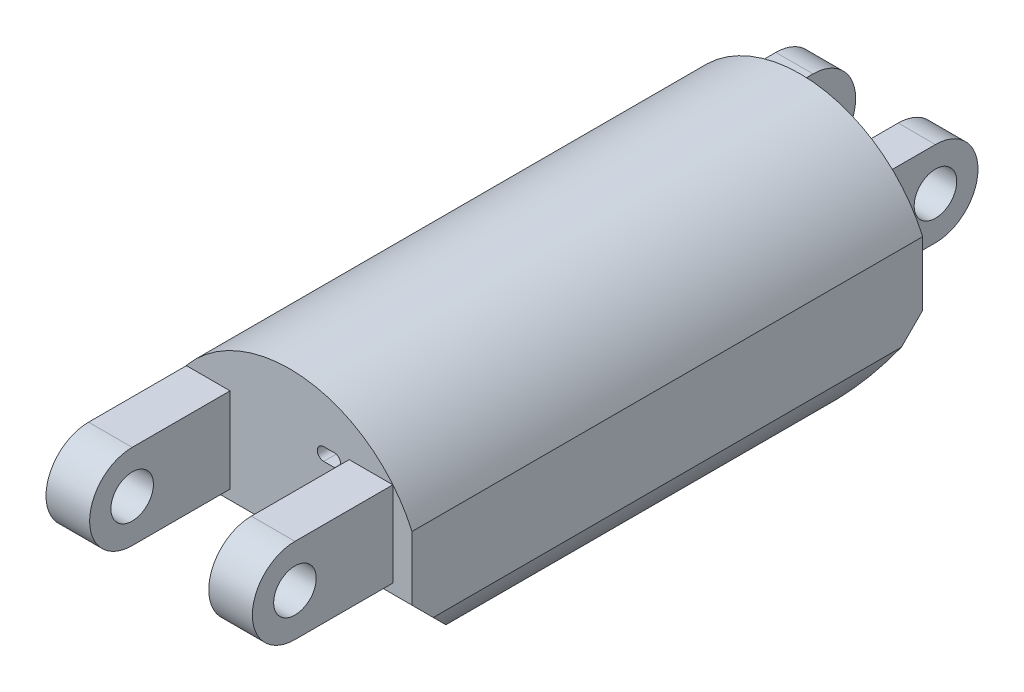
from build123d import *

# Parameters (mm, degrees)
BOSS_EXTRUDE1_DEPTH      = 15.24
CUT_EXTRUDE1_DEPTH       = 24.290307668
CUT_EXTRUDE2_DEPTH       = 36.202432178
SKETCH4_R                = 1.27
BOSS_EXTRUDE2_DEPTH      = 0.635
SKETCH5_R                = 1.27
BOSS_EXTRUDE3_DEPTH      = 1.27
MIRROR2_COPY_1_SKETCH_R  = 1.27
MIRROR2_COPY_1_DEPTH     = 0.635
MIRROR2_COPY_2_SKETCH_R  = 1.27
MIRROR2_COPY_2_DEPTH     = 1.27
SKETCH21_R               = 1.27
CUT_EXTRUDE9_DEPTH       = 1.905
SKETCH22_R               = 1.27
BOSS_EXTRUDE12_DEPTH     = 1.27
MIRROR8_COPY_1_SKETCH_R  = 1.27
MIRROR8_COPY_1_DEPTH     = 1.27
CUT_EXTRUDE10_DEPTH      = 2.54
CUT_EXTRUDE10_DEPTH_BACK = 2.54
SKETCH23_R               = 1.27
SKETCH24_R               = 1.27
BOSS_EXTRUDE13_DEPTH     = 0.635
BOSS_EXTRUDE14_DEPTH     = 2.2225
BOSS_EXTRUDE15_START     = -2.2225
BOSS_EXTRUDE15_DEPTH     = 2.2225
CUT_EXTRUDE11_REACH      = 30.027
SKETCH27_R               = 1.27
CUT_EXTRUDE12_DEPTH      = 16.51
SKETCH29_R               = 1.27
CUT_EXTRUDE13_DEPTH      = 3.556
SKETCH30_R               = 1.27
BOSS_EXTRUDE16_DEPTH     = 2.032
BOSS_EXTRUDE17_START     = 2.032
SKETCH31_R               = 1.27
BOSS_EXTRUDE17_DEPTH     = 2.032
CUT_EXTRUDE14_DEPTH      = 13.97
SKETCH33_W               = 0.284935897
SKETCH33_H               = 2.320192308
CUT_EXTRUDE15_DEPTH      = 1


with BuildPart() as part:
    # Sketch1 → Boss-Extrude1 (new, symmetric)
    with BuildSketch(Plane.XY):
        with BuildLine():
            Line((0, 0), (0, 5.08))
            ThreePointArc((0, 5.08), (7.3025, 9.8425), (14.605, 5.08))
            Line((14.605, 5.08), (14.605, 0))
            ThreePointArc((14.605, 0), (7.3025, -4.7625), (0, 0))
        make_face()
    extrude(amount=BOSS_EXTRUDE1_DEPTH, both=True)

    # Sketch2 → Cut-Extrude1 (cut, through all)
    with BuildSketch(Plane(origin=(0, 0, 0), x_dir=(0, 0, -1), z_dir=(1, 0, 0))):
        Polygon((-15.24, 1.27), (-15.24, -4.7625), (-9.2075, -4.7625), align=None)
        Polygon((15.24, -4.7625), (9.2075, -4.7625), (15.24, 1.27), align=None)
    extrude(amount=CUT_EXTRUDE1_DEPTH, mode=Mode.SUBTRACT)

    # Sketch3 → Cut-Extrude2 (cut, through all)
    with BuildSketch(Plane.XY.offset(15.24)):
        with BuildLine():
            ThreePointArc((4.23940993, -2.656973684), (7.3025, -3.4925), (10.36559007, -2.656973684))
            ThreePointArc((10.36559007, -2.656973684), (7.3025, -0.3175), (4.23940993, -2.656973684))
        make_face()
    extrude(amount=-CUT_EXTRUDE2_DEPTH, mode=Mode.SUBTRACT)

    # Sketch4 → Boss-Extrude2 (add, symmetric)
    with BuildSketch(Plane(origin=(9.525, 0, 0), x_dir=(0, 0, -1), z_dir=(1, 0, 0))):
        with BuildLine():
            Line((-15.24, 6.9215), (-18.542, 6.9215))
            ThreePointArc((-18.542, 6.9215), (-21.082, 4.3815), (-18.542, 1.8415))
            Line((-18.542, 1.8415), (-15.24, 1.8415))
            Line((-15.24, 1.8415), (-15.24, 6.9215))
        make_face()
        with Locations((-18.542, 4.3815)):
            Circle(SKETCH4_R, mode=Mode.SUBTRACT)
    boss_extrude2 = extrude(amount=BOSS_EXTRUDE2_DEPTH, both=True)

    # Sketch5 → Boss-Extrude3 (add)
    with BuildSketch(Plane.ZY.offset(-8.89)):
        with BuildLine():
            Line((15.24, 6.9215), (15.24, 1.8415))
            Line((15.24, 1.8415), (18.542, 1.8415))
            ThreePointArc((18.542, 1.8415), (21.082, 4.3815), (18.542, 6.9215))
            Line((18.542, 6.9215), (15.24, 6.9215))
        make_face()
        with Locations((18.542, 4.3815)):
            Circle(SKETCH5_R, mode=Mode.SUBTRACT)
    boss_extrude3 = extrude(amount=BOSS_EXTRUDE3_DEPTH)

    # Mirror1: Boss-Extrude2, Boss-Extrude3 across plane
    add(boss_extrude2.mirror(Plane(origin=(7.3025, 0, 0), x_dir=(0, 0, 1), z_dir=(1, 0, 0))))
    add(boss_extrude3.mirror(Plane(origin=(7.3025, 0, 0), x_dir=(0, 0, 1), z_dir=(1, 0, 0))))

    # Mirror2: Boss-Extrude2, Boss-Extrude3 across plane
    add(boss_extrude2.mirror(Plane.XY))
    add(boss_extrude3.mirror(Plane.XY))

    # Mirror2 copy 1 sketch → Mirror2 copy 1 (add, symmetric)
    with BuildSketch(Plane.ZY.offset(-5.08)):
        with BuildLine():
            Line((-15.24, 6.9215), (-18.542, 6.9215))
            ThreePointArc((-18.542, 6.9215), (-21.082, 4.3815), (-18.542, 1.8415))
            Line((-18.542, 1.8415), (-15.24, 1.8415))
            Line((-15.24, 1.8415), (-15.24, 6.9215))
        make_face()
        with Locations((-18.542, 4.3815)):
            Circle(MIRROR2_COPY_1_SKETCH_R, mode=Mode.SUBTRACT)
    extrude(amount=MIRROR2_COPY_1_DEPTH, both=True)

    # Mirror2 copy 2 sketch → Mirror2 copy 2 (add)
    with BuildSketch(Plane(origin=(5.715, 0, 0), x_dir=(0, 0, -1), z_dir=(1, 0, 0))):
        with BuildLine():
            Line((15.24, 6.9215), (15.24, 1.8415))
            Line((15.24, 1.8415), (18.542, 1.8415))
            ThreePointArc((18.542, 1.8415), (21.082, 4.3815), (18.542, 6.9215))
            Line((18.542, 6.9215), (15.24, 6.9215))
        make_face()
        with Locations((18.542, 4.3815)):
            Circle(MIRROR2_COPY_2_SKETCH_R, mode=Mode.SUBTRACT)
    extrude(amount=MIRROR2_COPY_2_DEPTH)

    # Sketch21 → Cut-Extrude9 (cut, symmetric)
    with BuildSketch(Plane(origin=(7.3025, 0, 0), x_dir=(0, 0, -1), z_dir=(1, 0, 0))):
        with BuildLine():
            Line((-15.24, 1.8415), (-15.24, 6.9215))
            Line((-15.24, 6.9215), (-18.542, 6.9215))
            ThreePointArc((-18.542, 6.9215), (-21.082, 4.3815), (-18.542, 1.8415))
            Line((-18.542, 1.8415), (-15.24, 1.8415))
        make_face()
        with Locations((-18.542, 4.3815)):
            Circle(SKETCH21_R, mode=Mode.SUBTRACT)
    cut_extrude9 = extrude(amount=CUT_EXTRUDE9_DEPTH, both=True, mode=Mode.SUBTRACT)

    # Sketch22 → Boss-Extrude12 (add)
    with BuildSketch(Plane(origin=(10.16, 0, 0), x_dir=(0, 0, -1), z_dir=(1, 0, 0))):
        with BuildLine():
            Line((-15.24, 1.8415), (-15.24, 6.9215))
            Line((-15.24, 6.9215), (-18.542, 6.9215))
            ThreePointArc((-18.542, 6.9215), (-21.082, 4.3815), (-18.542, 1.8415))
            Line((-18.542, 1.8415), (-15.24, 1.8415))
        make_face()
        with Locations((-18.542, 4.3815)):
            Circle(SKETCH22_R, mode=Mode.SUBTRACT)
    boss_extrude12 = extrude(amount=BOSS_EXTRUDE12_DEPTH)

    # Mirror7: Boss-Extrude12 across plane
    add(boss_extrude12.mirror(Plane(origin=(7.3025, 0, 0), x_dir=(0, 0, 1), z_dir=(1, 0, 0))))

    # Mirror8: Cut-Extrude9, Boss-Extrude12 across plane
    add(cut_extrude9.mirror(Plane.XY), mode=Mode.SUBTRACT)
    add(boss_extrude12.mirror(Plane.XY))

    # Mirror8 copy 1 sketch → Mirror8 copy 1 (add)
    with BuildSketch(Plane.ZY.offset(-4.445)):
        with BuildLine():
            Line((-15.24, 1.8415), (-15.24, 6.9215))
            Line((-15.24, 6.9215), (-18.542, 6.9215))
            ThreePointArc((-18.542, 6.9215), (-21.082, 4.3815), (-18.542, 1.8415))
            Line((-18.542, 1.8415), (-15.24, 1.8415))
        make_face()
        with Locations((-18.542, 4.3815)):
            Circle(MIRROR8_COPY_1_SKETCH_R, mode=Mode.SUBTRACT)
    extrude(amount=MIRROR8_COPY_1_DEPTH)

    # Sketch23 → Cut-Extrude10 (cut, two sides: drawn at the far end of the back side and taken through both)
    with BuildSketch(Plane(origin=(7.3025, 0, 0), x_dir=(0, 0, -1), z_dir=(1, 0, 0)).offset(-CUT_EXTRUDE10_DEPTH_BACK)):
        with BuildLine():
            Line((15.24, 1.8415), (18.542, 1.8415))
            ThreePointArc((18.542, 1.8415), (21.082, 4.3815), (18.542, 6.9215))
            Line((18.542, 6.9215), (15.24, 6.9215))
            Line((15.24, 6.9215), (15.24, 1.8415))
        make_face()
        with Locations((18.542, 4.3815)):
            Circle(SKETCH23_R, mode=Mode.SUBTRACT)
    extrude(amount=CUT_EXTRUDE10_DEPTH + CUT_EXTRUDE10_DEPTH_BACK, mode=Mode.SUBTRACT)

    # Sketch24 → Boss-Extrude13 (add)
    with BuildSketch(Plane.ZY.offset(-3.175)):
        with BuildLine():
            Line((-18.542, 1.8415), (-15.24, 1.8415))
            Line((-15.24, 1.8415), (-15.24, 6.9215))
            Line((-15.24, 6.9215), (-18.542, 6.9215))
            ThreePointArc((-18.542, 6.9215), (-21.082, 4.3815), (-18.542, 1.8415))
        make_face()
        with Locations(Location((-18.542, 4.3815, 0), (0, 0, 180))):
            Circle(SKETCH24_R, mode=Mode.SUBTRACT)
    boss_extrude13 = extrude(amount=BOSS_EXTRUDE13_DEPTH)

    # Mirror9: Boss-Extrude13 across plane
    add(boss_extrude13.mirror(Plane(origin=(7.3025, 0, 0), x_dir=(0, 0, 1), z_dir=(1, 0, 0))))

    # Sketch25 → Boss-Extrude14 (add)
    with BuildSketch(Plane(origin=(11.43, 0, 0), x_dir=(0, 0, -1), z_dir=(1, 0, 0))):
        with BuildLine():
            Line((-15.24, 6.9215), (-21.082, 6.9215))
            ThreePointArc((-21.082, 6.9215), (-23.622, 4.3815), (-21.082, 1.8415))
            Line((-21.082, 1.8415), (-15.24, 1.8415))
            Line((-15.24, 1.8415), (-15.24, 6.9215))
        make_face()
    extrude(amount=-BOSS_EXTRUDE14_DEPTH)

    # Sketch26 → Boss-Extrude15 (add)
    with BuildSketch(Plane.ZY.offset(-3.175).offset(BOSS_EXTRUDE15_START)):
        with BuildLine():
            Line((15.24, 6.9215), (21.082, 6.9215))
            ThreePointArc((21.082, 6.9215), (23.622, 4.3815), (21.082, 1.8415))
            Line((21.082, 1.8415), (15.24, 1.8415))
            Line((15.24, 1.8415), (15.24, 6.9215))
        make_face()
    extrude(amount=BOSS_EXTRUDE15_DEPTH)

    # Sketch27 → Cut-Extrude11 (cut, up to next)
    with BuildSketch(Plane(origin=(11.43, 0, 0), x_dir=(0, 0, -1), z_dir=(1, 0, 0)), mode=Mode.PRIVATE) as cut_extrude11_sk1:
        with Locations((-21.082, 4.3815)):
            Circle(SKETCH27_R)
    cut_extrude11_tool1 = extrude(cut_extrude11_sk1.sketch, amount=-CUT_EXTRUDE11_REACH, mode=Mode.PRIVATE) & part.part
    add(cut_extrude11_tool1.solids().sort_by_distance((11.43, 4.3815, 21.082))[0], mode=Mode.SUBTRACT)
    add(cut_extrude11_tool1.solids().sort_by_distance((11.43, 4.3815, 21.082))[1], mode=Mode.SUBTRACT)

    # Sketch28 → Cut-Extrude12 (cut)
    with BuildSketch(Plane(origin=(0, 0, -15.24), x_dir=(-1, 0, 0), z_dir=(0, 0, -1))):
        with BuildLine():
            Line((-5.7785, 5.9436), (-5.1435, 5.9436))
            ThreePointArc((-5.1435, 5.9436), (-4.7625, 5.5626), (-5.1435, 5.1816))
            Line((-5.1435, 5.1816), (-5.7785, 5.1816))
            ThreePointArc((-5.7785, 5.1816), (-6.1595, 5.5626), (-5.7785, 5.9436))
        make_face()
    extrude(amount=-CUT_EXTRUDE12_DEPTH, mode=Mode.SUBTRACT)

    # Sketch29 → Cut-Extrude13 (cut, symmetric)
    with BuildSketch(Plane.ZY.offset(-7.3025)):
        with BuildLine():
            Line((15.24, 1.8415), (21.082, 1.8415))
            ThreePointArc((21.082, 1.8415), (23.622, 4.3815), (21.082, 6.9215))
            Line((21.082, 6.9215), (15.24, 6.9215))
            Line((15.24, 6.9215), (15.24, 1.8415))
        make_face()
        with Locations(Location((21.082, 4.3815, 0), (0, 0, 180))):
            Circle(SKETCH29_R, mode=Mode.SUBTRACT)
    extrude(amount=CUT_EXTRUDE13_DEPTH, both=True, mode=Mode.SUBTRACT)

    # Sketch30 → Boss-Extrude16 (add)
    with BuildSketch(Plane.ZY.offset(-3.175)):
        with BuildLine():
            Line((15.24, 1.8415), (21.082, 1.8415))
            ThreePointArc((21.082, 1.8415), (23.622, 4.3815), (21.082, 6.9215))
            Line((21.082, 6.9215), (15.24, 6.9215))
            Line((15.24, 6.9215), (15.24, 1.8415))
        make_face()
        with Locations(Location((21.082, 4.3815, 0), (0, 0, 180))):
            Circle(SKETCH30_R, mode=Mode.SUBTRACT)
    extrude(amount=BOSS_EXTRUDE16_DEPTH)

    # Sketch31 → Boss-Extrude17 (add)
    with BuildSketch(Plane(origin=(11.43, 0, 0), x_dir=(0, 0, -1), z_dir=(1, 0, 0)).offset(BOSS_EXTRUDE17_START)):
        with BuildLine():
            Line((-21.082, 1.8415), (-15.24, 1.8415))
            Line((-15.24, 1.8415), (-15.24, 6.9215))
            Line((-15.24, 6.9215), (-21.082, 6.9215))
            ThreePointArc((-21.082, 6.9215), (-23.622, 4.3815), (-21.082, 1.8415))
        make_face()
        with Locations((-21.082, 4.3815)):
            Circle(SKETCH31_R, mode=Mode.SUBTRACT)
    extrude(amount=-BOSS_EXTRUDE17_DEPTH)

    # Sketch32 → Cut-Extrude14 (cut)
    with BuildSketch(Plane.XY.offset(15.24)):
        with BuildLine():
            Line((9.3345, 6.8326), (9.9695, 6.8326))
            ThreePointArc((9.9695, 6.8326), (10.3505, 6.4516), (9.9695, 6.0706))
            Line((9.9695, 6.0706), (9.3345, 6.0706))
            ThreePointArc((9.3345, 6.0706), (8.9535, 6.4516), (9.3345, 6.8326))
        make_face()
    extrude(amount=-CUT_EXTRUDE14_DEPTH, mode=Mode.SUBTRACT)

    # Sketch33 → Cut-Extrude15 (cut)
    # profile 1 of 7: a face of its own
    with BuildSketch(Plane.ZY):
        with BuildLine():
            Line((-10.277520447, 4.441727576), (-9.654859189, 4.441727576))
            add(Edge.make_bspline(
                [(-9.654859189, 4.441727576), (-9.612032153, 4.441680499), (-9.529973649, 4.441590297), (-9.412303563, 4.438855491), (-9.305433306, 4.435202706), (-9.209593318, 4.430139132), (-9.124488715, 4.424155082), (-9.050504593, 4.415762161), (-8.987059424, 4.406998893), (-8.949044288, 4.398089474), (-8.931707146, 4.394026254)],
                knots=[0, 0, 0, 0, 1.415646017, 2.712440637, 3.8905458, 4.950247383, 5.884950622, 6.709939814, 7.411656543, 8, 8, 8, 8], degree=3))
            add(Edge.make_bspline(
                [(-8.931707146, 4.394026254), (-8.909760154, 4.3880192), (-8.866383325, 4.376146639), (-8.803880236, 4.352367047), (-8.744413533, 4.324171083), (-8.687779191, 4.292036509), (-8.634673158, 4.254584604), (-8.584303107, 4.213333537), (-8.537113553, 4.1673309), (-8.493369862, 4.117092657), (-8.453197224, 4.063462181), (-8.418608155, 4.005638872), (-8.389645599, 3.944596047), (-8.36480506, 3.880376165), (-8.346926676, 3.812439943), (-8.333458417, 3.741259425), (-8.324909841, 3.666842242), (-8.324091088, 3.615987934), (-8.323674293, 3.590099972)],
                knots=[0, 0, 0, 0, 0.999701418, 1.975846123, 2.934577507, 3.890451536, 4.834027766, 5.787354733, 6.749476667, 7.726910423, 8.712836071, 9.690891519, 10.682875813, 11.679750201, 12.712814741, 13.765529915, 14.8625177, 16, 16, 16, 16], degree=3))
            add(Edge.make_bspline(
                [(-8.323674293, 3.590099972), (-8.324056585, 3.563994417), (-8.324804566, 3.512917136), (-8.333781911, 3.43819325), (-8.345874299, 3.366784425), (-8.364468054, 3.298848995), (-8.388820914, 3.234790403), (-8.417388705, 3.173629714), (-8.451845193, 3.11640744), (-8.491437289, 3.06291584), (-8.535480521, 3.013104706), (-8.583788543, 2.967334999), (-8.63616633, 2.925874635), (-8.692447422, 2.888630666), (-8.753180499, 2.856466756), (-8.817444452, 2.827658343), (-8.885797863, 2.803463881), (-8.933098572, 2.790736611), (-8.957147851, 2.784265637)],
                knots=[0, 0, 0, 0, 1.121902311, 2.195077645, 3.232258892, 4.234102512, 5.217864754, 6.176164875, 7.132989551, 8.084763148, 9.034132444, 9.988522005, 10.94243251, 11.903244335, 12.886203696, 13.894208494, 14.929344452, 16, 16, 16, 16], degree=3))
            add(Edge.make_bspline(
                [(-8.957147851, 2.784265637), (-8.977039075, 2.780035647), (-9.02063185, 2.770765378), (-9.092425605, 2.760416278), (-9.176014634, 2.751582883), (-9.271284845, 2.744959708), (-9.378150723, 2.739289731), (-9.496670078, 2.73478296), (-9.627075562, 2.732306593), (-9.718035905, 2.732178874), (-9.765526256, 2.732112191)],
                knots=[0, 0, 0, 0, 0.601384939, 1.31797006, 2.144135048, 3.087295005, 4.142315834, 5.309527816, 6.595305764, 8, 8, 8, 8], degree=3))
            Line((-9.765526256, 2.732112191), (-9.992584549, 2.732112191))
            Line((-9.992584549, 2.732112191), (-9.992584549, 1.266727576))
            Line((-9.992584549, 1.266727576), (-10.277520447, 1.266727576))
            Line((-10.277520447, 1.266727576), (-10.277520447, 4.441727576))
        make_face()
        with BuildLine():
            Line((-9.992584549, 4.11608655), (-9.992584549, 3.057753217))
            Line((-9.992584549, 3.057753217), (-9.436705142, 3.050757023))
            add(Edge.make_bspline(
                [(-9.436705142, 3.050757023), (-9.409563495, 3.050742996), (-9.357167105, 3.050715915), (-9.281478532, 3.054331082), (-9.211257249, 3.058504423), (-9.146718956, 3.064614868), (-9.087834558, 3.073252008), (-9.034505871, 3.081971228), (-8.987146408, 3.094585378), (-8.931720703, 3.111569877), (-8.869959381, 3.140537321), (-8.802769533, 3.182583292), (-8.745827644, 3.236177935), (-8.696553189, 3.296437468), (-8.65745, 3.363474535), (-8.628824207, 3.435201356), (-8.612004729, 3.510882334), (-8.609749396, 3.562669431), (-8.60861019, 3.588827937)],
                knots=[0, 0, 0, 0, 1.160613943, 2.240541288, 3.23993089, 4.169200891, 5.011653406, 5.7853311, 6.478053781, 7.106038997, 8.262395093, 9.384106736, 10.481365981, 11.59014053, 12.70357646, 13.786202915, 14.881775077, 16, 16, 16, 16], degree=3))
            add(Edge.make_bspline(
                [(-8.60861019, 3.588827937), (-8.609755591, 3.614353588), (-8.612032506, 3.665095424), (-8.628956039, 3.739461871), (-8.657394345, 3.810432832), (-8.696815685, 3.876629845), (-8.744659424, 3.936672546), (-8.800266685, 3.988830654), (-8.863506572, 4.030760341), (-8.922333182, 4.057823389), (-8.974585686, 4.074347246), (-9.019971821, 4.085908637), (-9.071216933, 4.095139366), (-9.128337705, 4.102613772), (-9.190891404, 4.109012269), (-9.259415447, 4.113353834), (-9.333650252, 4.115895155), (-9.385185555, 4.116021207), (-9.411900455, 4.11608655)],
                knots=[0, 0, 0, 0, 1.120700087, 2.227813068, 3.331159281, 4.466773991, 5.599788987, 6.693661531, 7.80175334, 8.91857717, 9.525282508, 10.207424825, 10.974604443, 11.810962634, 12.737642355, 13.736264703, 14.826523623, 16, 16, 16, 16], degree=3))
            Line((-9.411900455, 4.11608655), (-9.992584549, 4.11608655))
        make_face(mode=Mode.SUBTRACT)
    # profile 2 of 7: a face of its own
    with BuildSketch(Plane.ZY):
        with BuildLine():
            add(Edge.make_bspline(
                [(-7.653311713, 4.563842961), (-7.635630305, 4.563022765), (-7.601006712, 4.561416665), (-7.550938534, 4.54766304), (-7.505348244, 4.524349754), (-7.464909872, 4.493071757), (-7.430209947, 4.456287619), (-7.405916017, 4.413415169), (-7.390301914, 4.36709769), (-7.388416368, 4.334789716), (-7.387456344, 4.318340156)],
                knots=[0, 0, 0, 0, 1.055194115, 2.066272739, 3.074728998, 4.095836921, 5.109056067, 6.073838105, 7.019297344, 8, 8, 8, 8], degree=3))
            add(Edge.make_bspline(
                [(-7.387456344, 4.318340156), (-7.388438018, 4.302317607), (-7.39037867, 4.270642922), (-7.405903956, 4.225128415), (-7.430416986, 4.182851672), (-7.464887622, 4.146138957), (-7.50535414, 4.114878251), (-7.550936968, 4.091560381), (-7.601007124, 4.077807971), (-7.635630444, 4.076201703), (-7.653311713, 4.075381422)],
                knots=[0, 0, 0, 0, 0.96129708, 1.900370562, 2.859976407, 3.87933698, 4.906634145, 5.921202961, 6.938410037, 8, 8, 8, 8], degree=3))
            add(Edge.make_bspline(
                [(-7.653311713, 4.075381422), (-7.670790791, 4.076170383), (-7.704811533, 4.077705991), (-7.754130026, 4.091830222), (-7.799331584, 4.114886231), (-7.839848823, 4.14593427), (-7.873621927, 4.183077141), (-7.898203979, 4.225102615), (-7.913693409, 4.270649491), (-7.915638893, 4.302319813), (-7.916623011, 4.318340156)],
                knots=[0, 0, 0, 0, 1.054934014, 2.053291228, 3.073705704, 4.106921865, 5.123545215, 6.088680038, 7.033164197, 8, 8, 8, 8], degree=3))
            add(Edge.make_bspline(
                [(-7.916623011, 4.318340156), (-7.915660454, 4.334787427), (-7.913769931, 4.367090904), (-7.898192368, 4.413441399), (-7.873826686, 4.456060332), (-7.83982646, 4.493276321), (-7.799337535, 4.524341823), (-7.754128488, 4.547393213), (-7.704811939, 4.561518642), (-7.670790929, 4.563054085), (-7.653311713, 4.563842961)],
                knots=[0, 0, 0, 0, 0.98631895, 1.937192651, 2.907499808, 3.917963147, 4.944918757, 5.95915025, 6.951458133, 8, 8, 8, 8], degree=3))
        make_face()
    # profile 3 of 7: a face of its own
    with BuildSketch(Plane.ZY):
        with Locations((-7.652039678, 2.42682373)):
            Rectangle(SKETCH33_W, SKETCH33_H)
    # profile 4 of 7: a face of its own
    with BuildSketch(Plane.ZY):
        with BuildLine():
            Line((-6.817584549, 3.586919884), (-6.532648652, 3.586919884))
            Line((-6.532648652, 3.586919884), (-6.532648652, 3.168420284))
            add(Edge.make_bspline(
                [(-6.532648652, 3.168420284), (-6.502225226, 3.206377612), (-6.443187506, 3.280035129), (-6.344867432, 3.376845936), (-6.240959751, 3.456624819), (-6.132100791, 3.520218975), (-6.018142775, 3.568158414), (-5.899780344, 3.602780366), (-5.776304861, 3.623540175), (-5.692335693, 3.626252741), (-5.649856184, 3.627625012)],
                knots=[0, 0, 0, 0, 1.12780773, 2.188550248, 3.19190651, 4.159438251, 5.104880172, 6.052711206, 7.014878035, 8, 8, 8, 8], degree=3))
            add(Edge.make_bspline(
                [(-5.649856184, 3.627625012), (-5.606920537, 3.62604187), (-5.52288512, 3.62294328), (-5.40053145, 3.598435282), (-5.286255586, 3.556574944), (-5.180464989, 3.499232565), (-5.085099588, 3.427925265), (-5.001347759, 3.344851134), (-4.932075384, 3.249296258), (-4.885632062, 3.160647395), (-4.855038082, 3.082008275), (-4.835777318, 3.014655866), (-4.819420642, 2.939618686), (-4.805240414, 2.857123487), (-4.795645462, 2.766592272), (-4.788077812, 2.668396151), (-4.782654282, 2.562566933), (-4.782439102, 2.489372635), (-4.782328139, 2.451628417)],
                knots=[0, 0, 0, 0, 1.235846778, 2.418850247, 3.575807741, 4.728682307, 5.871620074, 6.994088408, 8.11269785, 9.256955736, 9.865816715, 10.540099792, 11.271859618, 12.076849838, 12.949306005, 13.892391288, 14.913166135, 16, 16, 16, 16], degree=3))
            Line((-4.782328139, 2.451628417), (-4.782328139, 1.266727576))
            Line((-4.782328139, 1.266727576), (-5.067264037, 1.266727576))
            Line((-5.067264037, 1.266727576), (-5.067264037, 2.358133826))
            add(Edge.make_bspline(
                [(-5.067264037, 2.358133826), (-5.067439304, 2.389722758), (-5.06777456, 2.450147009), (-5.068831968, 2.536660338), (-5.071380864, 2.61511602), (-5.074962548, 2.685326489), (-5.080204955, 2.747224326), (-5.085668342, 2.800935598), (-5.092349428, 2.846392112), (-5.098302927, 2.873756151), (-5.100972971, 2.886028458)],
                knots=[0, 0, 0, 0, 1.430800155, 2.736877192, 3.918605307, 4.986035426, 5.920637409, 6.731861385, 7.431261377, 8, 8, 8, 8], degree=3))
            add(Edge.make_bspline(
                [(-5.100972971, 2.886028458), (-5.110611846, 2.922052175), (-5.129163698, 2.991386686), (-5.17500524, 3.085434135), (-5.232893818, 3.165442491), (-5.303558296, 3.230917089), (-5.3863161, 3.281872062), (-5.48093758, 3.317227006), (-5.586509632, 3.339339765), (-5.660763251, 3.34154152), (-5.699465559, 3.342689115)],
                knots=[0, 0, 0, 0, 1.084156227, 2.086665306, 3.027808233, 3.945421172, 4.874247719, 5.839848303, 6.874090471, 8, 8, 8, 8], degree=3))
            add(Edge.make_bspline(
                [(-5.699465559, 3.342689115), (-5.722386958, 3.34225731), (-5.767747814, 3.341402781), (-5.835012431, 3.332829103), (-5.900257931, 3.318806076), (-5.96413912, 3.29987524), (-6.025378333, 3.273874468), (-6.085943083, 3.244365682), (-6.143552791, 3.207582661), (-6.199435872, 3.166588311), (-6.251426776, 3.121159316), (-6.299803198, 3.073221796), (-6.342926973, 3.022171784), (-6.381996414, 2.968831832), (-6.41572241, 2.912469379), (-6.445161997, 2.853628187), (-6.470140806, 2.792230809), (-6.482552963, 2.749617718), (-6.488763436, 2.728296086)],
                knots=[0, 0, 0, 0, 1.023777757, 2.026029729, 3.023749952, 4.003683103, 4.997618607, 5.993177895, 7.010360494, 8.046726602, 9.087585522, 10.09234134, 11.086953743, 12.070360549, 13.043493632, 14.017870808, 15.008233677, 16, 16, 16, 16], degree=3))
            add(Edge.make_bspline(
                [(-6.488763436, 2.728296086), (-6.49233726, 2.712643152), (-6.500117288, 2.678567533), (-6.508520315, 2.622647238), (-6.516147187, 2.557958903), (-6.522530714, 2.484578016), (-6.526436342, 2.402247658), (-6.53069483, 2.311319433), (-6.532245193, 2.211430769), (-6.5325104, 2.141887662), (-6.532648652, 2.105634828)],
                knots=[0, 0, 0, 0, 0.615963638, 1.340920617, 2.168419149, 3.115676021, 4.16674242, 5.331190069, 6.6087489, 8, 8, 8, 8], degree=3))
            Line((-6.532648652, 2.105634828), (-6.532648652, 1.266727576))
            Line((-6.532648652, 1.266727576), (-6.817584549, 1.266727576))
            Line((-6.817584549, 1.266727576), (-6.817584549, 3.586919884))
        make_face()
    # profile 5 of 7: a face of its own
    with BuildSketch(Plane.ZY):
        Polygon((-4.131046088, 4.523137833), (-3.84611019, 4.523137833), (-3.84611019, 2.640525653), (-2.790320928, 3.586919884), (-2.380725575, 3.586919884), (-3.605695527, 2.487881422), (-2.25861019, 1.266727576), (-2.667569525, 1.266727576), (-3.84611019, 2.335873209), (-3.84611019, 1.266727576), (-4.131046088, 1.266727576), align=None)
    # profile 6 of 7: a face of its own
    with BuildSketch(Plane.ZY):
        Polygon((-2.177199934, 3.586919884), (-1.87000342, 3.586919884), (-1.084521649, 1.809886631), (-0.286955543, 3.586919884), (0.020876989, 3.586919884), (-1.403802498, 0.411919884), (-1.71163503, 0.411919884), (-1.239073932, 1.464529058), align=None)
    # profile 7 of 7: a face of its own
    with BuildSketch(Plane.ZY):
        with BuildLine():
            Line((1.81190263, 3.709035268), (1.526966733, 3.709035268))
            add(Edge.make_bspline(
                [(1.526966733, 3.709035268), (1.534686111, 3.740996165), (1.549776864, 3.803477102), (1.581252519, 3.892746546), (1.615541844, 3.977222883), (1.656716246, 4.055324322), (1.701627759, 4.128620469), (1.75308337, 4.195448889), (1.808709119, 4.257509222), (1.870236037, 4.312584802), (1.934759894, 4.362457456), (2.003189871, 4.40497983), (2.07414921, 4.441559597), (2.148129552, 4.471695093), (2.225351151, 4.494396818), (2.30511588, 4.510867635), (2.38763277, 4.52156386), (2.443646655, 4.522607766), (2.472088928, 4.523137833)],
                knots=[0, 0, 0, 0, 1.162005537, 2.271625781, 3.343758855, 4.383309926, 5.390229558, 6.379919256, 7.361854164, 8.333198761, 9.295911338, 10.242430842, 11.177959212, 12.116337295, 13.062827104, 14.020064771, 14.994644689, 16, 16, 16, 16], degree=3))
            add(Edge.make_bspline(
                [(2.472088928, 4.523137833), (2.513529701, 4.521886674), (2.595507304, 4.519411647), (2.715942354, 4.496810694), (2.832080968, 4.461046467), (2.942651929, 4.411631015), (3.045357221, 4.350682523), (3.136739333, 4.278143083), (3.215559625, 4.195412289), (3.281685239, 4.104033462), (3.333460417, 4.006374536), (3.37163877, 3.905862965), (3.394881295, 3.802737176), (3.397893515, 3.733107359), (3.39940263, 3.698222969)],
                knots=[0, 0, 0, 0, 1.083050992, 2.142477498, 3.193116406, 4.255571735, 5.30263384, 6.308962982, 7.297363603, 8.282367274, 9.249857812, 10.179914175, 11.08814088, 12, 12, 12, 12], degree=3))
            add(Edge.make_bspline(
                [(3.39940263, 3.698222969), (3.398347087, 3.664652519), (3.396281552, 3.598960359), (3.378743119, 3.503055858), (3.349228081, 3.412666692), (3.308343368, 3.327412352), (3.255419247, 3.24783339), (3.191309015, 3.173750761), (3.115560172, 3.104835882), (3.058157135, 3.065357503), (3.028604353, 3.045032865)],
                knots=[0, 0, 0, 0, 1.024540389, 2.004866551, 2.965041327, 3.920577974, 4.882998113, 5.874504559, 6.905732034, 8, 8, 8, 8], degree=3))
            add(Edge.make_bspline(
                [(3.028604353, 3.045032865), (3.062378873, 3.028724095), (3.129295966, 2.996411705), (3.220509661, 2.933042553), (3.303311733, 2.859875724), (3.349488678, 2.802777746), (3.37268989, 2.774089355)],
                knots=[0, 0, 0, 0, 1.015518401, 2.012035669, 3.001164323, 4, 4, 4, 4], degree=3))
            add(Edge.make_bspline(
                [(3.37268989, 2.774089355), (3.387967393, 2.75317268), (3.41827222, 2.711681856), (3.45567874, 2.644973812), (3.489614151, 2.57752639), (3.516057564, 2.507531786), (3.536535286, 2.435801266), (3.551172973, 2.362211664), (3.5602663, 2.286702887), (3.561568551, 2.235619423), (3.562223143, 2.209941719)],
                knots=[0, 0, 0, 0, 1.025084078, 2.033381695, 3.024893161, 4.013698104, 4.991890475, 5.976764909, 6.982997093, 8, 8, 8, 8], degree=3))
            add(Edge.make_bspline(
                [(3.562223143, 2.209941719), (3.560595263, 2.1654829), (3.557347163, 2.076774487), (3.528314896, 1.945715275), (3.483308599, 1.81760357), (3.419394093, 1.695071394), (3.341499996, 1.580426334), (3.248828709, 1.477849968), (3.142433181, 1.389676949), (3.023773771, 1.31600767), (2.89521609, 1.257117841), (2.757715374, 1.216244303), (2.613252826, 1.189623289), (2.514186206, 1.18676863), (2.463820699, 1.18531732)],
                knots=[0, 0, 0, 0, 0.955779014, 1.907060117, 2.875433937, 3.871313158, 4.872415639, 5.851225146, 6.836215519, 7.83643374, 8.849228613, 9.86973379, 10.916971861, 12, 12, 12, 12], degree=3))
            add(Edge.make_bspline(
                [(2.463820699, 1.18531732), (2.429876048, 1.186104913), (2.363084294, 1.187654634), (2.264891978, 1.198248794), (2.171164436, 1.217598156), (2.081774944, 1.243636154), (1.996644089, 1.276648663), (1.916031651, 1.317759197), (1.839441676, 1.366120345), (1.767596913, 1.422302957), (1.700505927, 1.485151029), (1.63995167, 1.555780274), (1.584924572, 1.632885062), (1.536898036, 1.717360977), (1.493684514, 1.808116318), (1.458141789, 1.90631317), (1.426858452, 2.011073675), (1.412313809, 2.084078482), (1.404851348, 2.121535268)],
                knots=[0, 0, 0, 0, 1.048658725, 2.063410685, 3.046034179, 4.001477787, 4.936774919, 5.862367409, 6.792675028, 7.730719943, 8.675894397, 9.627829632, 10.600096036, 11.597688215, 12.626045268, 13.701542398, 14.82072376, 16, 16, 16, 16], degree=3))
            Line((1.404851348, 2.121535268), (1.689787245, 2.121535268))
            add(Edge.make_bspline(
                [(1.689787245, 2.121535268), (1.69721066, 2.097088664), (1.711649846, 2.049537894), (1.736228244, 1.981102759), (1.764230177, 1.918366525), (1.794269812, 1.860868979), (1.825818831, 1.808043871), (1.861120228, 1.761288032), (1.897559381, 1.718547813), (1.92502708, 1.694468058), (1.938470138, 1.682683105)],
                knots=[0, 0, 0, 0, 1.198163088, 2.33053128, 3.407730985, 4.417276592, 5.372219308, 6.28897303, 7.162600585, 8, 8, 8, 8], degree=3))
            add(Edge.make_bspline(
                [(1.938470138, 1.682683105), (1.956247032, 1.668977688), (1.991745948, 1.641609159), (2.049592843, 1.606682682), (2.110430276, 1.576419466), (2.175576445, 1.553302113), (2.243625558, 1.533728092), (2.315677525, 1.520918764), (2.391096672, 1.512130209), (2.442593143, 1.511354664), (2.46890884, 1.510958345)],
                knots=[0, 0, 0, 0, 0.946170439, 1.889420265, 2.845303464, 3.807233317, 4.801018734, 5.828864929, 6.890507805, 8, 8, 8, 8], degree=3))
            add(Edge.make_bspline(
                [(2.46890884, 1.510958345), (2.498620946, 1.511517059), (2.556720404, 1.512609576), (2.641497312, 1.522656825), (2.722149068, 1.537289414), (2.797780222, 1.559889049), (2.869381468, 1.587811678), (2.935949108, 1.622871303), (2.998357004, 1.664005443), (3.055805822, 1.710758823), (3.107463532, 1.761941179), (3.152947233, 1.815474465), (3.191613891, 1.871132968), (3.222804708, 1.929224692), (3.247434136, 1.989509078), (3.264201039, 2.052155302), (3.275859199, 2.116650679), (3.276808626, 2.160491958), (3.277287245, 2.182592961)],
                knots=[0, 0, 0, 0, 1.217147791, 2.380027433, 3.494444702, 4.572153297, 5.609568379, 6.639424714, 7.649109417, 8.668170816, 9.669597737, 10.625200337, 11.543417969, 12.441394052, 13.322311151, 14.205496177, 15.095365482, 16, 16, 16, 16], degree=3))
            add(Edge.make_bspline(
                [(3.277287245, 2.182592961), (3.275899043, 2.212176104), (3.273129547, 2.271195188), (3.251985335, 2.358024702), (3.217206508, 2.441684512), (3.168517873, 2.520747265), (3.109249034, 2.594022547), (3.039975154, 2.659401677), (2.960120975, 2.713349546), (2.88662438, 2.750622827), (2.821523131, 2.776056459), (2.765810603, 2.79299732), (2.703438542, 2.807342565), (2.635161211, 2.820688697), (2.56046415, 2.832047348), (2.479428682, 2.841519567), (2.392038384, 2.849098782), (2.331539969, 2.852483419), (2.300364168, 2.854227576)],
                knots=[0, 0, 0, 0, 1.07054697, 2.135767047, 3.216561865, 4.33974944, 5.486079747, 6.621378074, 7.775625952, 8.963672916, 9.598146892, 10.304877434, 11.070270905, 11.915000392, 12.823868403, 13.805723172, 14.86925407, 16, 16, 16, 16], degree=3))
            Line((2.300364168, 2.854227576), (2.300364168, 3.179868602))
            add(Edge.make_bspline(
                [(2.300364168, 3.179868602), (2.339644512, 3.180535174), (2.416585055, 3.181840824), (2.528974888, 3.197632377), (2.636447107, 3.219476946), (2.736619937, 3.252937085), (2.827922699, 3.291799354), (2.907134052, 3.33702243), (2.97314425, 3.387291524), (3.025632508, 3.443382534), (3.065119736, 3.503539756), (3.093991188, 3.566238438), (3.11104577, 3.632028122), (3.113322397, 3.676926856), (3.114466733, 3.699495004)],
                knots=[0, 0, 0, 0, 1.321986639, 2.589447074, 3.816329219, 5.01088745, 6.139805852, 7.153945165, 8.075214402, 8.924034688, 9.728124013, 10.488707548, 11.240355623, 12, 12, 12, 12], degree=3))
            add(Edge.make_bspline(
                [(3.114466733, 3.699495004), (3.114090803, 3.71607553), (3.113342908, 3.7490617), (3.103911092, 3.797253727), (3.089737854, 3.843972442), (3.070252671, 3.88901917), (3.044172134, 3.93208149), (3.012960989, 3.973526533), (2.97579707, 4.013117675), (2.933210843, 4.050020536), (2.887480134, 4.085189773), (2.837360695, 4.115047143), (2.784363709, 4.140578735), (2.7284305, 4.16163307), (2.669379555, 4.177471138), (2.607488321, 4.188842937), (2.542638779, 4.19595281), (2.498395851, 4.196976444), (2.475905034, 4.197496807)],
                knots=[0, 0, 0, 0, 0.884392785, 1.759457502, 2.611959086, 3.489218968, 4.37281399, 5.2945488, 6.255912374, 7.266815255, 8.301784654, 9.332968512, 10.37626691, 11.440494194, 12.520033166, 13.637162961, 14.798855837, 16, 16, 16, 16], degree=3))
            add(Edge.make_bspline(
                [(2.475905034, 4.197496807), (2.439753878, 4.196234643), (2.369142262, 4.193769343), (2.267347302, 4.172176609), (2.172714763, 4.137725062), (2.100380401, 4.096601537), (2.046965495, 4.056006501), (2.008795701, 4.020553193), (1.971312095, 3.981153417), (1.93698066, 3.935380463), (1.902260695, 3.88633416), (1.8706517, 3.831521249), (1.839936122, 3.772371548), (1.821428095, 3.730556223), (1.81190263, 3.709035268)],
                knots=[0, 0, 0, 0, 1.472543308, 2.876219568, 4.221790263, 5.565193594, 6.249813518, 6.953379497, 7.687249741, 8.463570142, 9.283606569, 10.136032583, 11.040678096, 12, 12, 12, 12], degree=3))
        make_face()
    extrude(amount=-CUT_EXTRUDE15_DEPTH, mode=Mode.SUBTRACT)


solid = part.part
